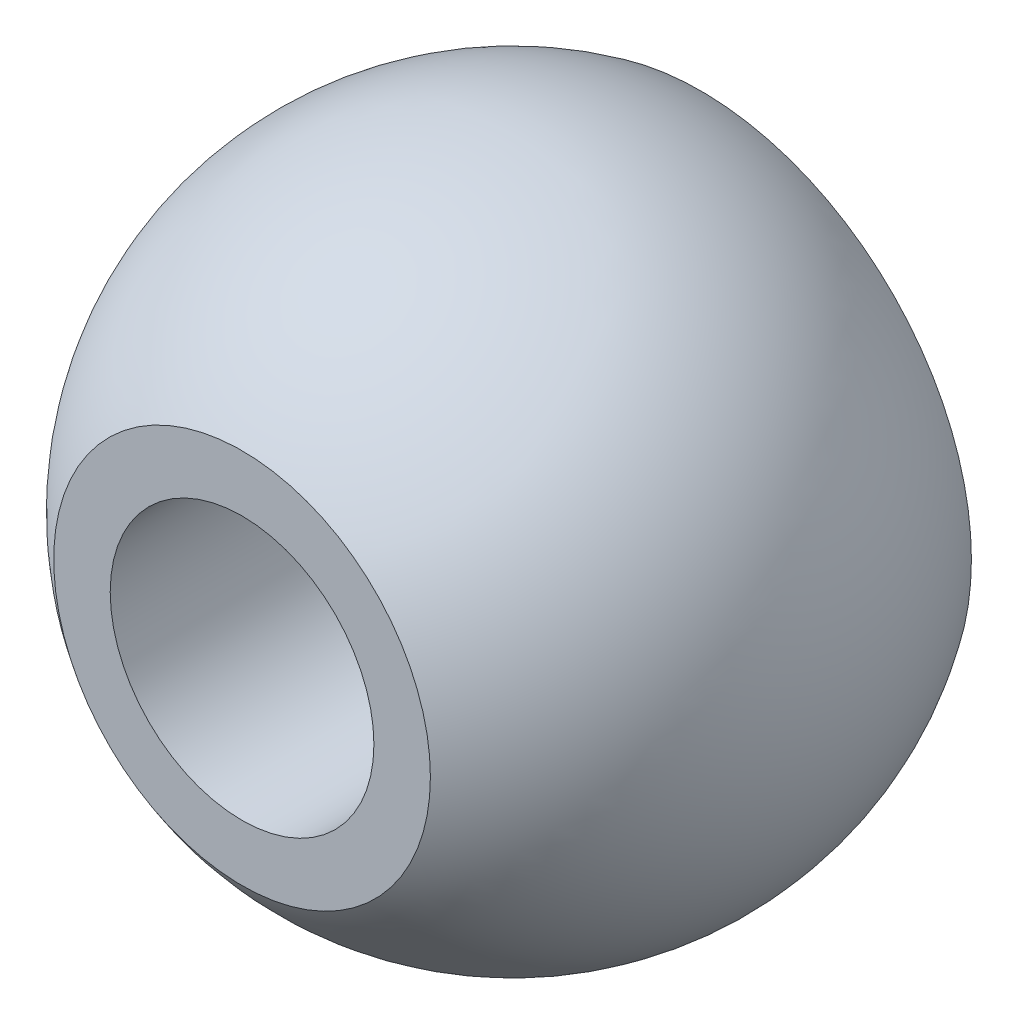
from build123d import *


with BuildPart() as part:
    # Sketch4 → Revolve2 (revolve)
    with BuildSketch(Plane(origin=(0, 0, 0), x_dir=(1, 0, 0), z_dir=(0, 1, 0))):
        with BuildLine():
            Line((12.308421985, 0), (10.1, 0))
            Line((10.1, 0), (10.1, -7.308421985))
            Line((10.1, -7.308421985), (11, -7.308421985))
            ThreePointArc((11, -7.308421985), (13.167834745, -3.925194058), (12.308421985, 0))
        make_face()
    revolve(axis=Axis((8, 0, 0), (0, 0, 1)))


solid = part.part
